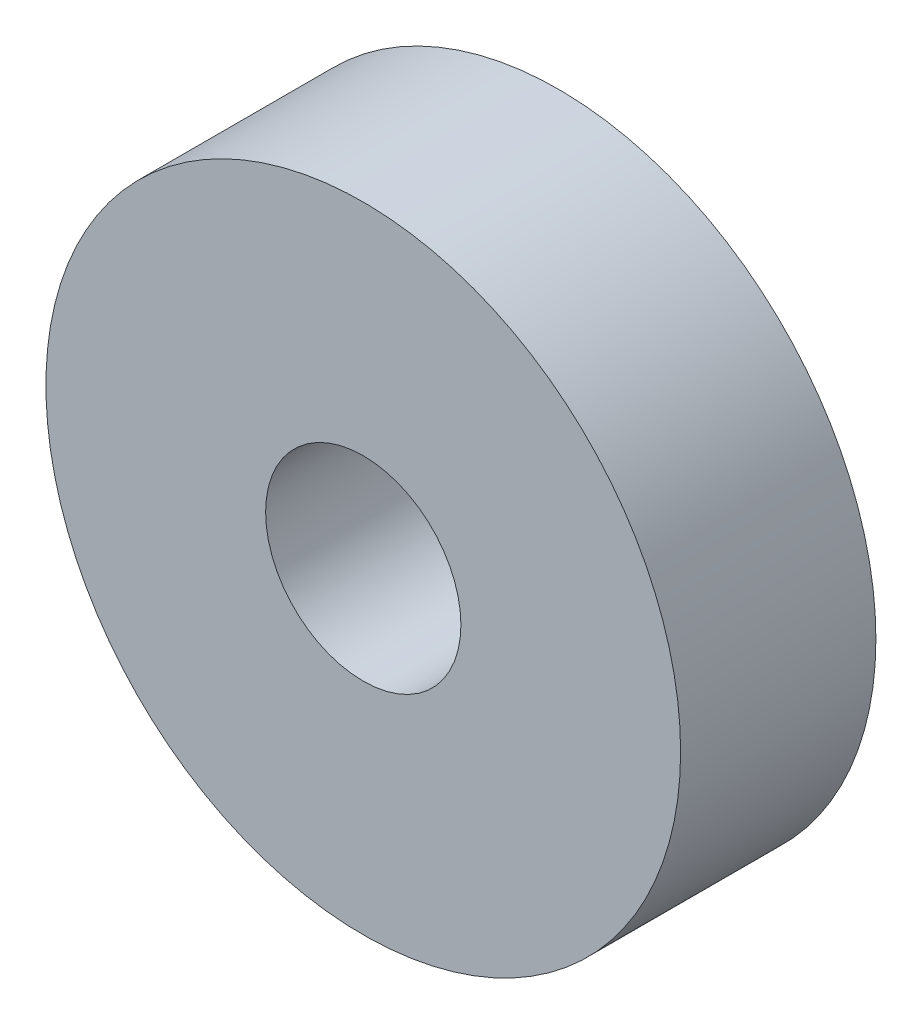
from build123d import *

# Parameters (mm, degrees)
SKETCH1_R           = 6.5
SKETCH1_R_2         = 2
BOSS_EXTRUDE1_DEPTH = 4


with BuildPart() as part:
    # Sketch1 → Boss-Extrude1 (new body)
    with BuildSketch(Plane.XY):
        Circle(SKETCH1_R)
        Circle(SKETCH1_R_2, mode=Mode.SUBTRACT)
    extrude(amount=BOSS_EXTRUDE1_DEPTH)


solid = part.part
